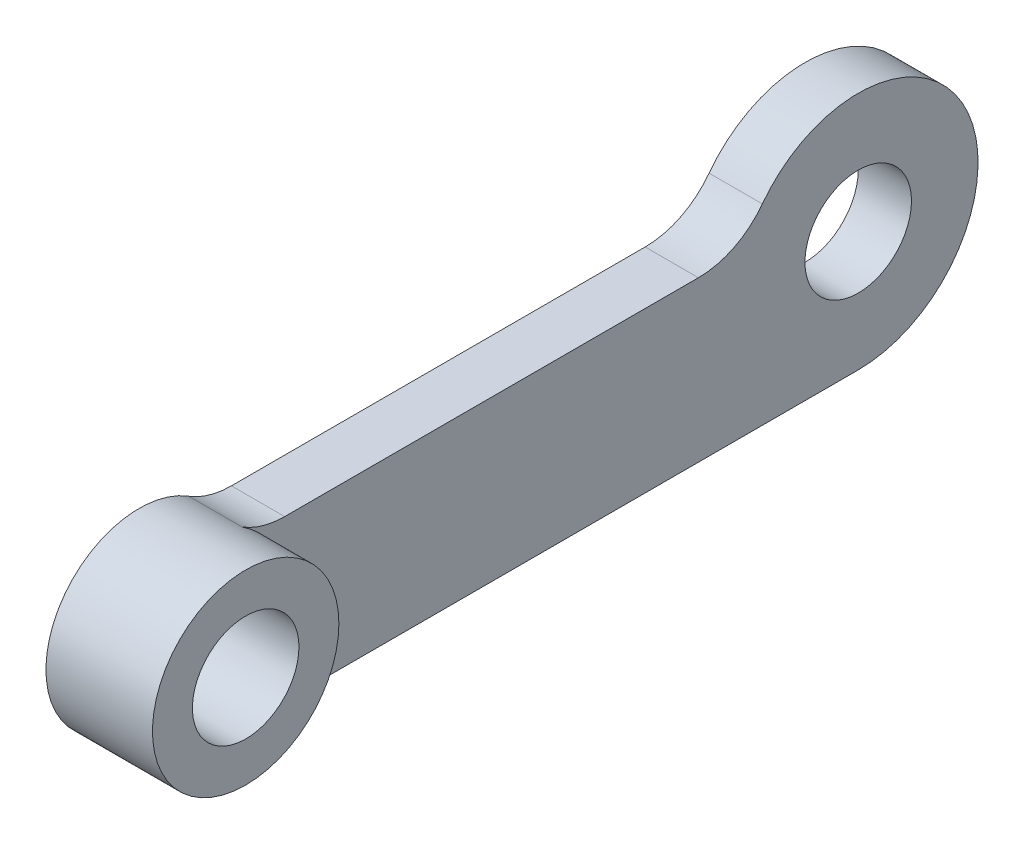
from build123d import *

# Parameters (mm, degrees)
SKETCH_1_R               = 3.5
SKETCH_1_R_2             = 4.5
SKETCH_1_W               = 25
SKETCH_1_H               = 6
EXTRUDE_1_DEPTH          = 2
EXTRUDE_START            = 2
SKETCH_1_5_R             = 3.5
EXTRUDE_3_DEPTH          = 2
CUT_EXTRUDE_2_DEPTH      = 31.368569278
CUT_EXTRUDE_2_DEPTH_BACK = 31.368569278
SKETCH_1_4_R             = 2
FILLET_1_R               = 3


with BuildPart() as part:
    # 草图1 → 凸台-拉伸1 (new body)
    with BuildSketch(Plane(origin=(0, 0, 0), x_dir=(0, 0, -1), z_dir=(1, 0, 0))):
        with Locations((0, -2.5)):
            Circle(SKETCH_1_R)
        with Locations((25, -1.5)):
            Circle(SKETCH_1_R_2)
        with Locations((12.5, -3)):
            Rectangle(SKETCH_1_W, SKETCH_1_H)
    extrude(amount=EXTRUDE_1_DEPTH)

    # 草图1<5> → 凸台-拉伸3 (add)
    with BuildSketch(Plane(origin=(0, 0, 0), x_dir=(0, 0, -1), z_dir=(1, 0, 0)).offset(EXTRUDE_START)):
        with Locations(Location((0, -2.5, 0), (0, 0, 270))):
            Circle(SKETCH_1_5_R)
    extrude(amount=EXTRUDE_3_DEPTH)

    # 草图1<4> → 切除-拉伸2 (cut, two sides: drawn at the far end of the back side and taken through both)
    with BuildSketch(Plane(origin=(0, 0, 0), x_dir=(0, 0, -1), z_dir=(1, 0, 0)).offset(-CUT_EXTRUDE_2_DEPTH_BACK)):
        with Locations((0, -2.5)):
            Circle(SKETCH_1_4_R)
        with Locations((25, -1.5)):
            Circle(SKETCH_1_4_R)
    extrude(amount=CUT_EXTRUDE_2_DEPTH + CUT_EXTRUDE_2_DEPTH_BACK, mode=Mode.SUBTRACT)

    # 圆角1
    fillet_1_edges = [part.edges().sort_by_distance(p)[0] for p in [
        (1, 0, -20.757359313),
        (1, 0, -2.449489743),
    ]]
    fillet(fillet_1_edges, radius=FILLET_1_R)


solid = part.part
